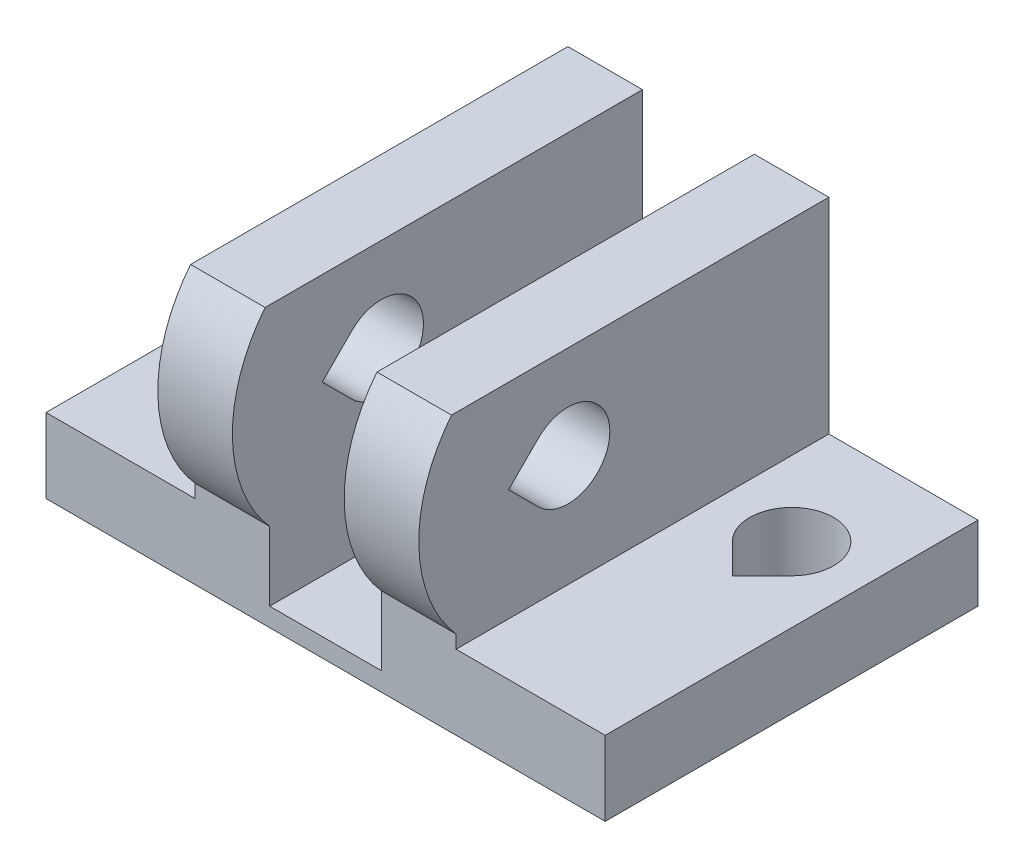
from build123d import *

# Parameters (mm, degrees)
BOSS_EXTRUDE1_DEPTH = 20
CUT_EXTRUDE1_DEPTH  = 28.313000567
CUT_EXTRUDE2_DEPTH  = 34.301651611
CUT_EXTRUDE3_DEPTH  = 6
BOSS_EXTRUDE2_DEPTH = 4


with BuildPart() as part:
    # Sketch1 → Boss-Extrude1 (new body)
    with BuildSketch(Plane.XY):
        Polygon((-15, 0), (15, 0), (15, 4), (7, 4), (7, 15), (3, 15), (3, 4), (-3, 4), (-3, 15), (-7, 15), (-7, 4), (-15, 4), align=None)
    extrude(amount=BOSS_EXTRUDE1_DEPTH)

    # Sketch2 → Cut-Extrude1 (cut, through all)
    with BuildSketch(Plane(origin=(0, 4, 0), x_dir=(1, 0, 0), z_dir=(0, 1, 0))):
        with BuildLine():
            Line((-12.590990258, -7.590990258), (-11, -9.181980515))
            Line((-11, -9.181980515), (-9.409009742, -7.590990258))
            ThreePointArc((-9.409009742, -7.590990258), (-11, -3.75), (-12.590990258, -7.590990258))
        make_face()
        with BuildLine():
            Line((9.409009742, -7.590990258), (11, -9.181980515))
            Line((11, -9.181980515), (12.590990258, -7.590990258))
            ThreePointArc((12.590990258, -7.590990258), (11, -3.75), (9.409009742, -7.590990258))
        make_face()
    extrude(amount=-CUT_EXTRUDE1_DEPTH, mode=Mode.SUBTRACT)

    # Sketch3 → Cut-Extrude2 (cut, through all)
    with BuildSketch(Plane(origin=(7, 0, 0), x_dir=(0, 0, -1), z_dir=(1, 0, 0))):
        with BuildLine():
            Line((-15.590990258, 11.590990258), (-17.181980515, 10))
            Line((-17.181980515, 10), (-15.590990258, 8.409009742))
            ThreePointArc((-15.590990258, 8.409009742), (-11.75, 10), (-15.590990258, 11.590990258))
        make_face()
    extrude(amount=-CUT_EXTRUDE2_DEPTH, mode=Mode.SUBTRACT)

    # Sketch4 → Cut-Extrude3 (cut)
    with BuildSketch(Plane(origin=(-3, 0, 0), x_dir=(0, 0, -1), z_dir=(1, 0, 0))):
        with BuildLine():
            Line((-14, 1), (-20, 1))
            Line((-20, 1), (-20, 3.291796068))
            ThreePointArc((-20, 3.291796068), (-10.788601192, 18.407551231), (-14, 1))
        make_face()
    extrude(amount=CUT_EXTRUDE3_DEPTH, mode=Mode.SUBTRACT)

    # Sketch5 → Boss-Extrude2 (add)
    with BuildSketch(Plane(origin=(7, 0, 0), x_dir=(0, 0, -1), z_dir=(1, 0, 0))):
        with BuildLine():
            Line((-20, 4.708497378), (-20, 15))
            Line((-20, 15), (-20.244997998, 15))
            ThreePointArc((-20.244997998, 15), (-21.997734089, 9.809607118), (-20, 4.708497378))
        make_face()
    boss_extrude2 = extrude(amount=-BOSS_EXTRUDE2_DEPTH)

    # Mirror1: Boss-Extrude2 across plane
    add(boss_extrude2.mirror(Plane(origin=(0, 0, 0), x_dir=(0, 0, 1), z_dir=(1, 0, 0))))


solid = part.part
